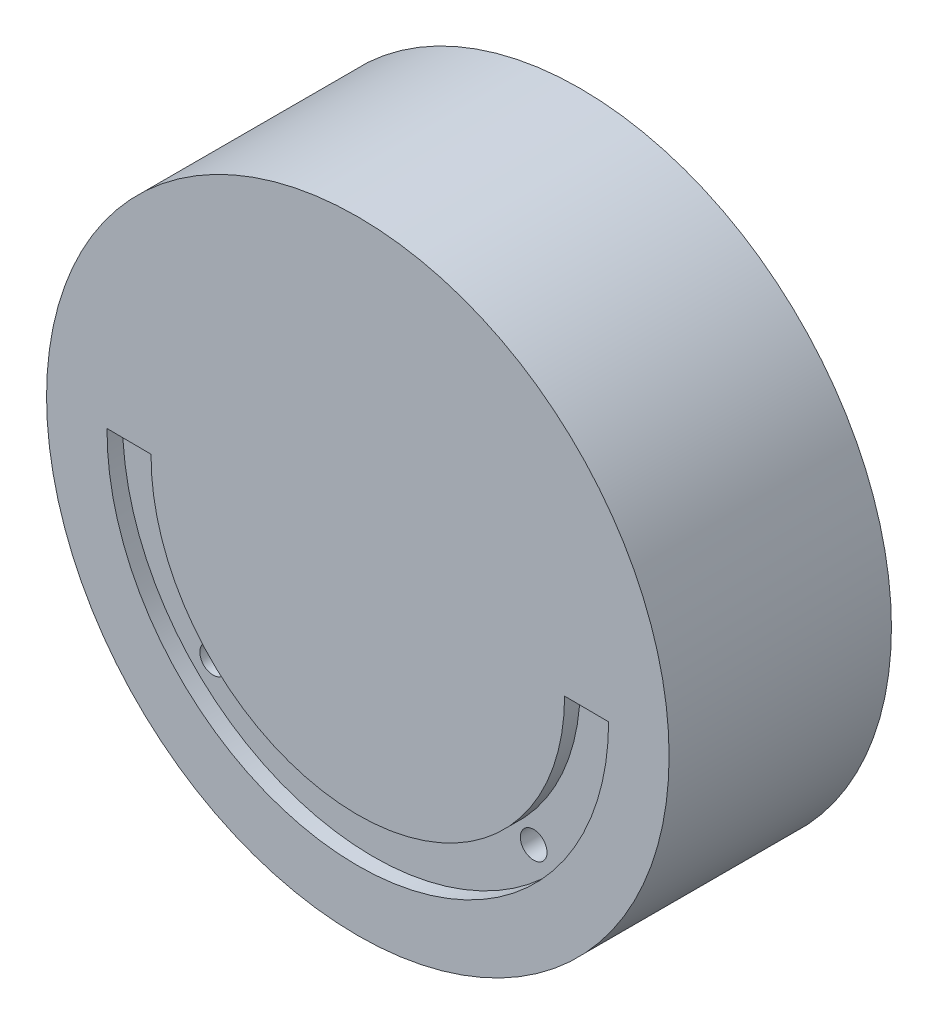
from build123d import *

# Parameters (mm, degrees)
SKETCH_1_R          = 70
EXTRUDE_1_DEPTH     = 50
CUT_EXTRUDE_1_DEPTH = 3.5
SKETCH_4_R          = 3
CUT_EXTRUDE_2_DEPTH = 6


with BuildPart() as part:
    # 스케치1 → 보스-돌출1 (new body)
    with BuildSketch(Plane.XY):
        Circle(SKETCH_1_R)
    extrude(amount=EXTRUDE_1_DEPTH)

    # 스케치3 → 컷-돌출1 (cut)
    with BuildSketch(Plane.XY.offset(50)):
        with BuildLine():
            Line((-56.397174638, 0.564528852), (-46.497305932, 0.500540781))
            ThreePointArc((-46.497305932, 0.500540781), (-0.300547739, -46.499028711), (46.499891289, -0.100549136))
            Line((46.499891289, -0.100549136), (56.399759995, -0.164537207))
            ThreePointArc((56.399759995, -0.164537207), (-0.364535322, -56.39882192), (-56.397174638, 0.564528852))
        make_face()
    extrude(amount=-CUT_EXTRUDE_1_DEPTH, mode=Mode.SUBTRACT)

    # 스케치4 → 컷-돌출2 (cut)
    with BuildSketch(Plane.XY.offset(46.5)):
        with Locations((-36.040115251, -36.040115251)):
            Circle(SKETCH_4_R)
        with Locations(Location((36.040115251, -36.040115251, 0), (0, 0, 180))):
            Circle(SKETCH_4_R)
    extrude(amount=-CUT_EXTRUDE_2_DEPTH, mode=Mode.SUBTRACT)


solid = part.part
